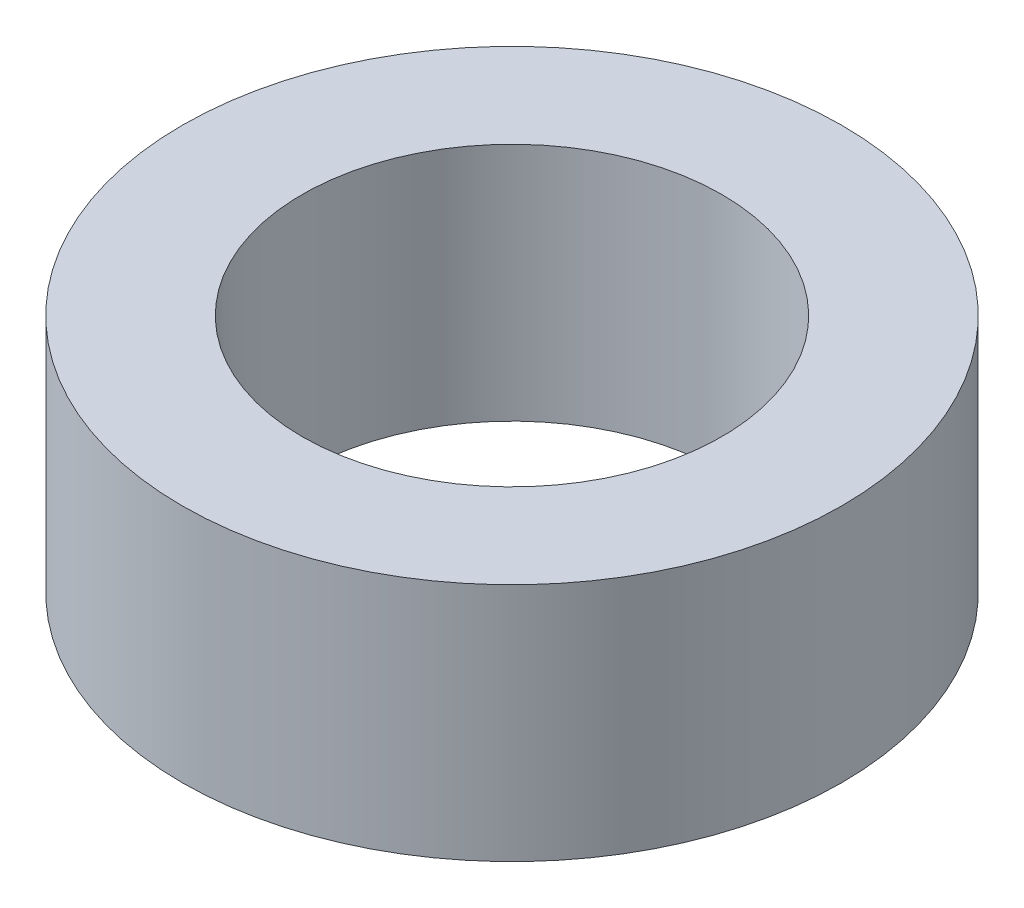
from build123d import *

# Parameters (mm, degrees)
SKETCH_1_R      = 2.75
SKETCH_1_R_2    = 1.75
EXTRUDE_1_DEPTH = 2


with BuildPart() as part:
    # 草图1 → 凸台-拉伸1 (new body)
    with BuildSketch(Plane(origin=(0, 0, 0), x_dir=(1, 0, 0), z_dir=(0, 1, 0))):
        with Locations(Location((0, 0, 0), (0, 0, 270))):
            Circle(SKETCH_1_R)
        with Locations(Location((0, 0, 0), (0, 0, 270))):
            Circle(SKETCH_1_R_2, mode=Mode.SUBTRACT)
    extrude(amount=EXTRUDE_1_DEPTH)


solid = part.part
